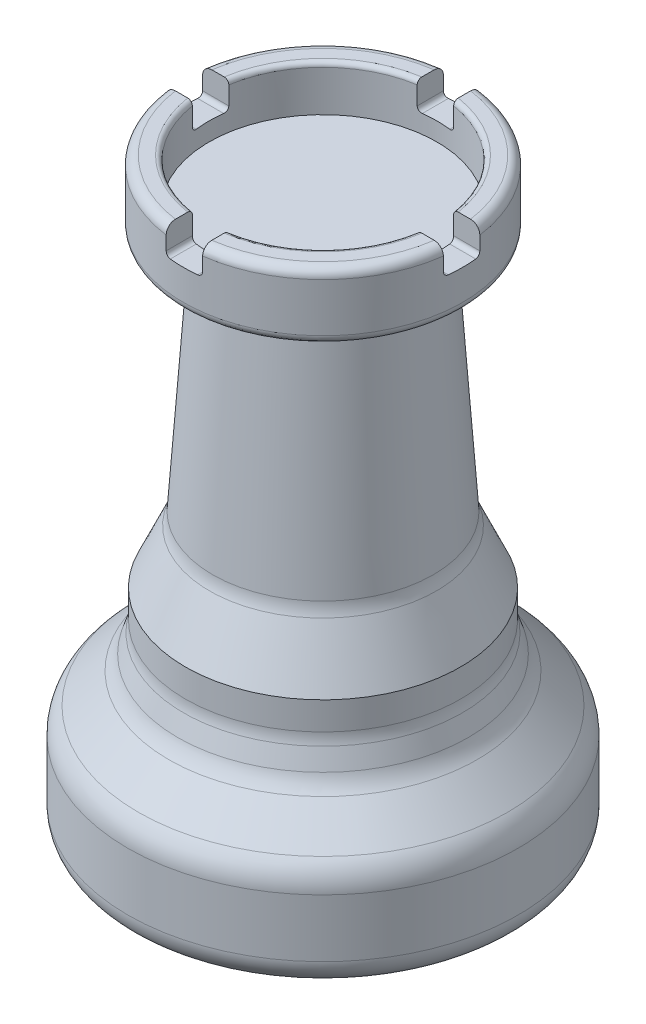
from build123d import *

# Parameters (mm, degrees)
SKETCH3_R          = 12.5
CUT_EXTRUDE1_DEPTH = 5
CUT_EXTRUDE2_DEPTH = 3
FILLET1_R          = 0.5
FILLET2_R          = 0.5


with BuildPart() as part:
    # Sketch2 → Revolve1 (revolve)
    with BuildSketch(Plane.XY, mode=Mode.PRIVATE) as revolve1_sk:
        with BuildLine():
            Line((1.072689454, 3), (1.072689454, 5.466621399))
            Line((1.072689454, 5.466621399), (1.072689454, 9.342864583))
            ThreePointArc((1.072689454, 9.342864583), (1.377171324, 10.873598312), (2.24426233, 12.171291707))
            Line((2.24426233, 12.171291707), (5.579393823, 15.5064232))
            ThreePointArc((5.579393823, 15.5064232), (6.166247856, 16.252578822), (6.560747732, 17.11601134))
            Line((6.560747732, 17.11601134), (7.207577899, 19.137838122))
            ThreePointArc((7.207577899, 19.137838122), (7.34995603, 19.739880599), (7.397796865, 20.356677106))
            Line((7.397796865, 20.356677106), (7.397796865, 23.409338687))
            Line((7.397796865, 23.409338687), (10.048685929, 29.308325435))
            ThreePointArc((10.048685929, 29.308325435), (10.280627573, 29.977374162), (10.39095928, 30.676838271))
            Line((10.39095928, 30.676838271), (12.006651099, 54.464097023))
            ThreePointArc((12.006651099, 54.464097023), (11.91625193, 54.952342947), (11.602151914, 55.336917091))
            Line((11.602151914, 55.336917091), (10.873692195, 55.873681057))
            Line((10.873692195, 55.873681057), (10.873692195, 57.181576197))
            Line((10.873692195, 57.181576197), (8.162097879, 57.181576197))
            ThreePointArc((8.162097879, 57.181576197), (7.454991098, 57.474469416), (7.162097879, 58.181576197))
            Line((7.162097879, 58.181576197), (7.162097879, 63.515067487))
            ThreePointArc((7.162097879, 63.515067487), (7.454991098, 64.222174269), (8.162097879, 64.515067487))
            Line((8.162097879, 64.515067487), (22.5, 64.515067487))
            Line((22.5, 64.515067487), (22.5, 0))
            Line((22.5, 0), (4.072689454, 0))
            ThreePointArc((4.072689454, 0), (1.951369111, 0.878679656), (1.072689454, 3))
        make_face()
    revolve(revolve1_sk.sketch.rotate(Axis((22.5, 0, 0), (0, 1, 0)), 270), axis=Axis((22.5, 0, 0), (0, 1, 0)))

    # Sketch3 → Cut-Extrude1 (cut)
    with BuildSketch(Plane(origin=(0, 64.515067487, 0), x_dir=(1, 0, 0), z_dir=(0, 1, 0))):
        with Locations(Location((22.5, 0, 0), (0, 0, 270))):
            Circle(SKETCH3_R)
    extrude(amount=-CUT_EXTRUDE1_DEPTH, mode=Mode.SUBTRACT)

    # Sketch4 → Cut-Extrude2 (cut)
    with BuildSketch(Plane(origin=(0, 64.515067487, 0), x_dir=(1, 0, 0), z_dir=(0, 1, 0))):
        Polygon((20.5, -2), (4.52491368, -2), (4.52491368, 2), (20.5, 2), (20.5, 18.565177538), (24.5, 18.565177538), (24.5, 2), (40.47508632, 2), (40.47508632, -2), (24.5, -2), (24.5, -18.565177538), (20.5, -18.565177538), align=None)
    extrude(amount=-CUT_EXTRUDE2_DEPTH, mode=Mode.SUBTRACT)

    # Fillet1
    fillet1_edges = [part.edges().sort_by_distance(p)[0] for p in [
        (8.727045088, 61.515067487, -2),
        (20.5, 61.515067487, -13.772954912),
        (24.5, 61.515067487, -13.772954912),
        (36.272954912, 61.515067487, -2),
        (36.272954912, 61.515067487, 2),
        (24.5, 61.515067487, 13.772954912),
        (20.5, 61.515067487, 13.772954912),
        (8.727045088, 61.515067487, 2),
    ]]
    fillet(fillet1_edges, radius=FILLET1_R)

    # Fillet2
    fillet2_edges = [part.edges().sort_by_distance(p)[0] for p in [
        (31.338834765, 64.515067487, 8.838834765),
        (31.338834765, 64.515067487, -8.838834765),
        (13.661165235, 64.515067487, -8.838834765),
        (13.661165235, 64.515067487, 8.838834765),
    ]]
    fillet(fillet2_edges, radius=FILLET2_R)


solid = part.part
